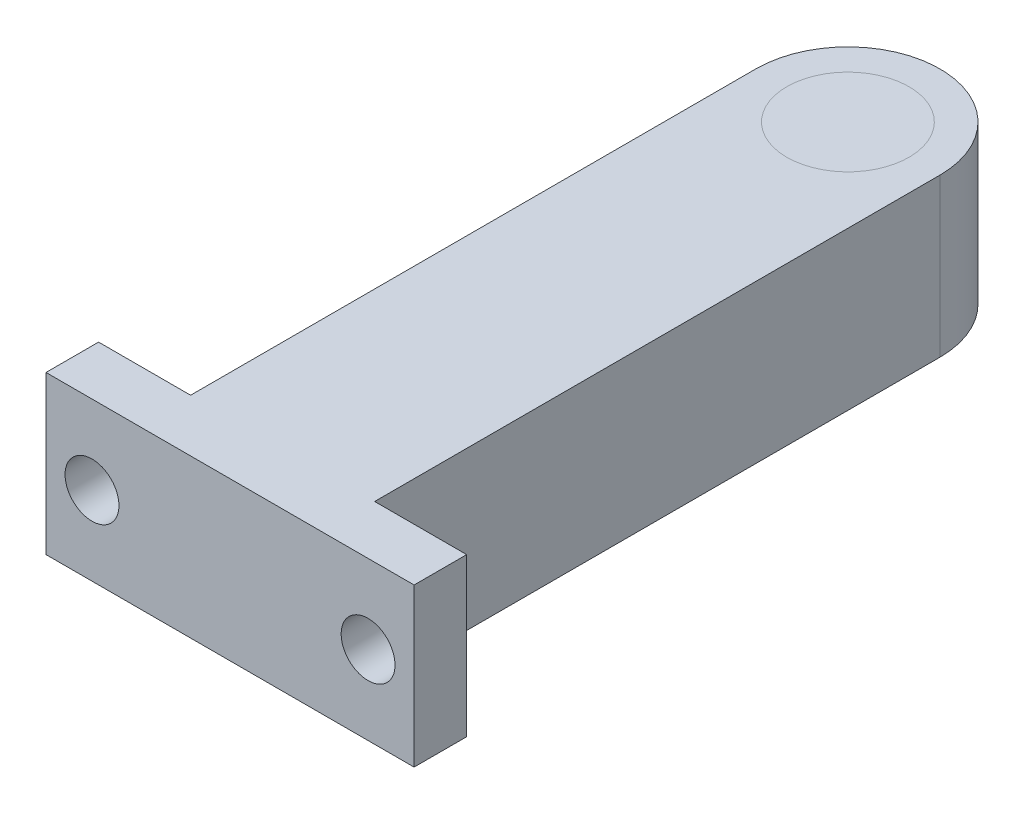
from build123d import *

# Parameters (mm, degrees)
SKETCH1_R                      = 2.325
BOSS_EXTRUDE1_DEPTH            = 6
SKETCH2_W                      = 14
SKETCH2_H                      = 6
BOSS_EXTRUDE2_DEPTH            = 2
TAP_DRILL_FOR_M2_5X0_45_TAP1_D = 2.05
SKETCH5_R                      = 2.325
BOSS_EXTRUDE3_DEPTH            = 0.5


with BuildPart() as part:
    # Sketch1 → Boss-Extrude1 (new body)
    with BuildSketch(Plane(origin=(0, 0, 0), x_dir=(1, 0, 0), z_dir=(0, 1, 0))):
        with BuildLine():
            ThreePointArc((3.5, 0), (0, 3.5), (-3.5, 0))
            Line((-3.5, 0), (-3.5, -21.5))
            Line((-3.5, -21.5), (3.5, -21.5))
            Line((3.5, -21.5), (3.5, 0))
        make_face()
        Circle(SKETCH1_R, mode=Mode.SUBTRACT)
    extrude(amount=BOSS_EXTRUDE1_DEPTH)

    # Sketch2 → Boss-Extrude2 (add)
    with BuildSketch(Plane.XY.offset(21.5)):
        with Locations((0, 3)):
            Rectangle(SKETCH2_W, SKETCH2_H)
    extrude(amount=BOSS_EXTRUDE2_DEPTH)

    # Tap Drill for M2.5x0.45 Tap1 (through all)
    with Locations(Plane(origin=(0, 0, 21.5), x_dir=(-1, 0, 0), z_dir=(0, 0, -1))):
        with Locations((5.25, 3), (-5.25, 3)):
            Hole(TAP_DRILL_FOR_M2_5X0_45_TAP1_D / 2)


with BuildPart() as body_2:
    # Sketch5 → Boss-Extrude3 (new body)
    with BuildSketch(Plane(origin=(0, 6, 0), x_dir=(1, 0, 0), z_dir=(0, 1, 0))):
        Circle(SKETCH5_R)
    extrude(amount=-BOSS_EXTRUDE3_DEPTH)


solid = Compound([part.part, body_2.part])
